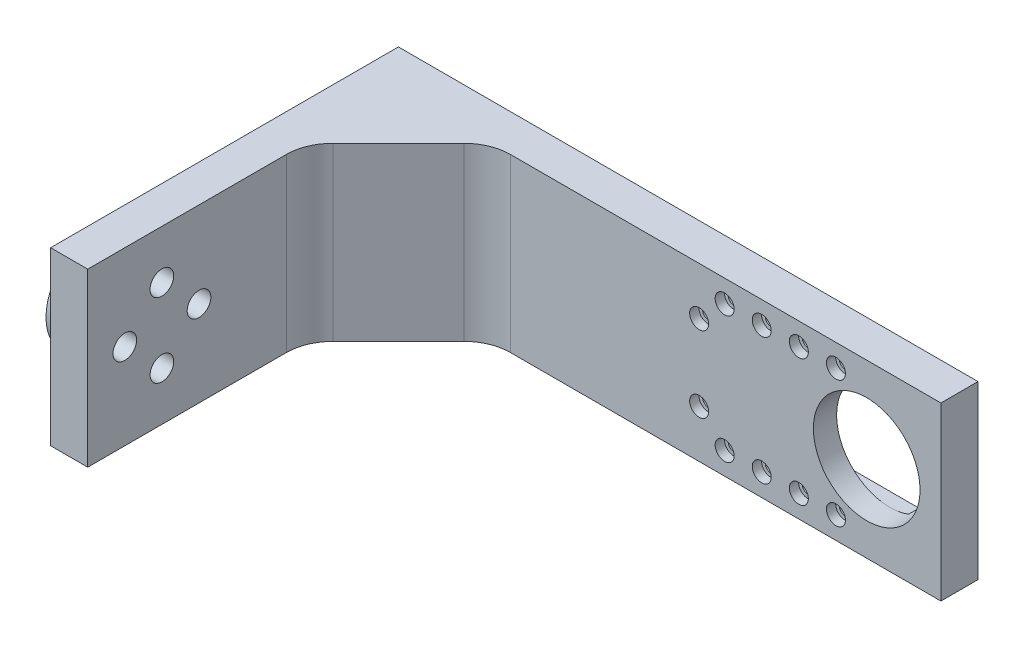
from build123d import *

# Parameters (mm, degrees)
BOSS_EXTRUDE1_DEPTH = 37
CUT_EXTRUDE1_REACH  = 152.396
CUT_EXTRUDE2_REACH  = 152.396
SKETCH3_R           = 1.25
CUT_EXTRUDE5_REACH  = 152.396
SKETCH5_R           = 1.25
BOSS_EXTRUDE3_START = 6
SKETCH6_R           = 11
SKETCH6_R_2         = 1.25
BOSS_EXTRUDE3_DEPTH = 6
SKETCH4_W           = 38
SKETCH4_H           = 23
CUT_EXTRUDE6_DEPTH  = 3
SKETCH9_R           = 2.05
CUT_EXTRUDE8_DEPTH  = 2
SKETCH10_R          = 2.55
CUT_EXTRUDE9_DEPTH  = 6
CHAMFER1_SIZE       = 20
FILLET5_R           = 10
CUT_EXTRUDE10_REACH = 148.571
SKETCH11_R          = 1.25
SKETCH12_R          = 2.05
CUT_EXTRUDE11_DEPTH = 2
SKETCH7_W           = 3
SKETCH7_H           = 23
BOSS_EXTRUDE4_DEPTH = 0.5


with BuildPart() as part:
    # Sketch1 → Boss-Extrude1 (new body)
    with BuildSketch(Plane(origin=(0, 0, 0), x_dir=(1, 0, 0), z_dir=(0, 1, 0))):
        Polygon((0, 0), (0, 75), (125, 75), (125, 67), (8, 67), (8, 0), align=None)
    extrude(amount=BOSS_EXTRUDE1_DEPTH)

    # Sketch2 → Cut-Extrude1 (cut, up to next)
    with BuildSketch(Plane(origin=(0, 0, -75), x_dir=(-1, 0, 0), z_dir=(0, 0, -1)), mode=Mode.PRIVATE) as cut_extrude1_sk1:
        with BuildLine():
            ThreePointArc((-120.5, 18.5), (-109, 7), (-97.5, 18.5))
            ThreePointArc((-97.5, 18.5), (-109, 30), (-120.5, 18.5))
        make_face()
    cut_extrude1_tool1 = extrude(cut_extrude1_sk1.sketch, amount=-CUT_EXTRUDE1_REACH, mode=Mode.PRIVATE) & part.part
    add(cut_extrude1_tool1.solids().sort_by_distance((109, 18.5, -75))[0], mode=Mode.SUBTRACT)

    # Sketch3 → Cut-Extrude2 (cut, up to next)
    with BuildSketch(Plane(origin=(0, 0, -75), x_dir=(-1, 0, 0), z_dir=(0, 0, -1)), mode=Mode.PRIVATE) as cut_extrude2_sk1:
        with Locations((-102.36, 32.19)):
            Circle(SKETCH3_R)
    cut_extrude2_tool1 = extrude(cut_extrude2_sk1.sketch, amount=-CUT_EXTRUDE2_REACH, mode=Mode.PRIVATE) & part.part
    # Sketch3 → Cut-Extrude2 (cut, up to next)
    with BuildSketch(Plane(origin=(0, 0, -75), x_dir=(-1, 0, 0), z_dir=(0, 0, -1)), mode=Mode.PRIVATE) as cut_extrude2_sk2:
        with Locations((-94.36, 32.19)):
            Circle(SKETCH3_R)
    cut_extrude2_tool2 = extrude(cut_extrude2_sk2.sketch, amount=-CUT_EXTRUDE2_REACH, mode=Mode.PRIVATE) & part.part
    # Sketch3 → Cut-Extrude2 (cut, up to next)
    with BuildSketch(Plane(origin=(0, 0, -75), x_dir=(-1, 0, 0), z_dir=(0, 0, -1)), mode=Mode.PRIVATE) as cut_extrude2_sk3:
        with Locations((-86.36, 32.19)):
            Circle(SKETCH3_R)
    cut_extrude2_tool3 = extrude(cut_extrude2_sk3.sketch, amount=-CUT_EXTRUDE2_REACH, mode=Mode.PRIVATE) & part.part
    # Sketch3 → Cut-Extrude2 (cut, up to next)
    with BuildSketch(Plane(origin=(0, 0, -75), x_dir=(-1, 0, 0), z_dir=(0, 0, -1)), mode=Mode.PRIVATE) as cut_extrude2_sk4:
        with Locations((-78.36, 32.19)):
            Circle(SKETCH3_R)
    cut_extrude2_tool4 = extrude(cut_extrude2_sk4.sketch, amount=-CUT_EXTRUDE2_REACH, mode=Mode.PRIVATE) & part.part
    # Sketch3 → Cut-Extrude2 (cut, up to next)
    with BuildSketch(Plane(origin=(0, 0, -75), x_dir=(-1, 0, 0), z_dir=(0, 0, -1)), mode=Mode.PRIVATE) as cut_extrude2_sk5:
        with Locations((-78.36, 4.81)):
            Circle(SKETCH3_R)
    cut_extrude2_tool5 = extrude(cut_extrude2_sk5.sketch, amount=-CUT_EXTRUDE2_REACH, mode=Mode.PRIVATE) & part.part
    # Sketch3 → Cut-Extrude2 (cut, up to next)
    with BuildSketch(Plane(origin=(0, 0, -75), x_dir=(-1, 0, 0), z_dir=(0, 0, -1)), mode=Mode.PRIVATE) as cut_extrude2_sk6:
        with Locations((-86.36, 4.81)):
            Circle(SKETCH3_R)
    cut_extrude2_tool6 = extrude(cut_extrude2_sk6.sketch, amount=-CUT_EXTRUDE2_REACH, mode=Mode.PRIVATE) & part.part
    # Sketch3 → Cut-Extrude2 (cut, up to next)
    with BuildSketch(Plane(origin=(0, 0, -75), x_dir=(-1, 0, 0), z_dir=(0, 0, -1)), mode=Mode.PRIVATE) as cut_extrude2_sk7:
        with Locations((-94.36, 4.81)):
            Circle(SKETCH3_R)
    cut_extrude2_tool7 = extrude(cut_extrude2_sk7.sketch, amount=-CUT_EXTRUDE2_REACH, mode=Mode.PRIVATE) & part.part
    # Sketch3 → Cut-Extrude2 (cut, up to next)
    with BuildSketch(Plane(origin=(0, 0, -75), x_dir=(-1, 0, 0), z_dir=(0, 0, -1)), mode=Mode.PRIVATE) as cut_extrude2_sk8:
        with Locations((-102.36, 4.81)):
            Circle(SKETCH3_R)
    cut_extrude2_tool8 = extrude(cut_extrude2_sk8.sketch, amount=-CUT_EXTRUDE2_REACH, mode=Mode.PRIVATE) & part.part
    add(cut_extrude2_tool1.solids().sort_by_distance((102.36, 32.19, -75))[0], mode=Mode.SUBTRACT)
    add(cut_extrude2_tool2.solids().sort_by_distance((94.36, 32.19, -75))[0], mode=Mode.SUBTRACT)
    add(cut_extrude2_tool3.solids().sort_by_distance((86.36, 32.19, -75))[0], mode=Mode.SUBTRACT)
    add(cut_extrude2_tool4.solids().sort_by_distance((78.36, 32.19, -75))[0], mode=Mode.SUBTRACT)
    add(cut_extrude2_tool5.solids().sort_by_distance((78.36, 4.81, -75))[0], mode=Mode.SUBTRACT)
    add(cut_extrude2_tool6.solids().sort_by_distance((86.36, 4.81, -75))[0], mode=Mode.SUBTRACT)
    add(cut_extrude2_tool7.solids().sort_by_distance((94.36, 4.81, -75))[0], mode=Mode.SUBTRACT)
    add(cut_extrude2_tool8.solids().sort_by_distance((102.36, 4.81, -75))[0], mode=Mode.SUBTRACT)

    # Sketch5 → Cut-Extrude5 (cut, up to next)
    with BuildSketch(Plane.ZY, mode=Mode.PRIVATE) as cut_extrude5_sk1:
        with Locations((-16, 10.5)):
            Circle(SKETCH5_R)
    cut_extrude5_tool1 = extrude(cut_extrude5_sk1.sketch, amount=-CUT_EXTRUDE5_REACH, mode=Mode.PRIVATE) & part.part
    # Sketch5 → Cut-Extrude5 (cut, up to next)
    with BuildSketch(Plane.ZY, mode=Mode.PRIVATE) as cut_extrude5_sk2:
        with Locations((-24, 18.5)):
            Circle(SKETCH5_R)
    cut_extrude5_tool2 = extrude(cut_extrude5_sk2.sketch, amount=-CUT_EXTRUDE5_REACH, mode=Mode.PRIVATE) & part.part
    # Sketch5 → Cut-Extrude5 (cut, up to next)
    with BuildSketch(Plane.ZY, mode=Mode.PRIVATE) as cut_extrude5_sk3:
        with Locations((-16, 26.5)):
            Circle(SKETCH5_R)
    cut_extrude5_tool3 = extrude(cut_extrude5_sk3.sketch, amount=-CUT_EXTRUDE5_REACH, mode=Mode.PRIVATE) & part.part
    # Sketch5 → Cut-Extrude5 (cut, up to next)
    with BuildSketch(Plane.ZY, mode=Mode.PRIVATE) as cut_extrude5_sk4:
        with Locations((-8, 18.5)):
            Circle(SKETCH5_R)
    cut_extrude5_tool4 = extrude(cut_extrude5_sk4.sketch, amount=-CUT_EXTRUDE5_REACH, mode=Mode.PRIVATE) & part.part
    add(cut_extrude5_tool1.solids().sort_by_distance((0, 10.5, -16))[0], mode=Mode.SUBTRACT)
    add(cut_extrude5_tool2.solids().sort_by_distance((0, 18.5, -24))[0], mode=Mode.SUBTRACT)
    add(cut_extrude5_tool3.solids().sort_by_distance((0, 26.5, -16))[0], mode=Mode.SUBTRACT)
    add(cut_extrude5_tool4.solids().sort_by_distance((0, 18.5, -8))[0], mode=Mode.SUBTRACT)

    # Sketch6 → Boss-Extrude3 (add)
    with BuildSketch(Plane.ZY.offset(BOSS_EXTRUDE3_START)):
        with Locations((-16, 18.5)):
            Circle(SKETCH6_R)
        with Locations((-16, 10.5)):
            Circle(SKETCH6_R_2, mode=Mode.SUBTRACT)
        with BuildLine():
            ThreePointArc((-9.25, 18.5), (-8, 19.75), (-6.75, 18.5))
            ThreePointArc((-6.75, 18.5), (-8, 17.25), (-9.25, 18.5))
        make_face(mode=Mode.SUBTRACT)
        with Locations((-24, 18.5)):
            Circle(SKETCH6_R_2, mode=Mode.SUBTRACT)
        with Locations((-16, 26.5)):
            Circle(SKETCH6_R_2, mode=Mode.SUBTRACT)
    extrude(amount=-BOSS_EXTRUDE3_DEPTH)

    # Sketch4 → Cut-Extrude6 (cut)
    with BuildSketch(Plane(origin=(0, 0, -75), x_dir=(-1, 0, 0), z_dir=(0, 0, -1))):
        with Locations((-94, 18.5)):
            Rectangle(SKETCH4_W, SKETCH4_H)
    extrude(amount=-CUT_EXTRUDE6_DEPTH, mode=Mode.SUBTRACT)

    # Sketch9 → Cut-Extrude8 (cut)
    with BuildSketch(Plane.XY.offset(-67)):
        with Locations((78.36, 32.19)):
            Circle(SKETCH9_R)
        with Locations((86.36, 32.19)):
            Circle(SKETCH9_R)
        with Locations((94.36, 32.19)):
            Circle(SKETCH9_R)
        with Locations((102.36, 32.19)):
            Circle(SKETCH9_R)
        with Locations((78.36, 4.81)):
            Circle(SKETCH9_R)
        with Locations((86.36, 4.81)):
            Circle(SKETCH9_R)
        with Locations((94.36, 4.81)):
            Circle(SKETCH9_R)
        with Locations((102.36, 4.81)):
            Circle(SKETCH9_R)
    extrude(amount=-CUT_EXTRUDE8_DEPTH, mode=Mode.SUBTRACT)

    # Sketch10 → Cut-Extrude9 (cut)
    with BuildSketch(Plane(origin=(8, 0, 0), x_dir=(0, 0, -1), z_dir=(1, 0, 0))):
        with Locations((24, 18.5)):
            Circle(SKETCH10_R)
        with Locations((16, 10.5)):
            Circle(SKETCH10_R)
        with Locations((8, 18.5)):
            Circle(SKETCH10_R)
        with Locations((16, 26.5)):
            Circle(SKETCH10_R)
    extrude(amount=-CUT_EXTRUDE9_DEPTH, mode=Mode.SUBTRACT)

    # Chamfer1
    chamfer1_edges = [part.edges().sort_by_distance(p)[0] for p in [
        (8, 18.5, -67),
    ]]
    chamfer(chamfer1_edges, length=CHAMFER1_SIZE)

    # Fillet5
    fillet5_edges = [part.edges().sort_by_distance(p)[0] for p in [
        (8, 18.5, -47),
        (28, 18.5, -67),
    ]]
    fillet(fillet5_edges, radius=FILLET5_R)

    # Sketch11 → Cut-Extrude10 (cut, up to next)
    with BuildSketch(Plane.XY.offset(-67), mode=Mode.PRIVATE) as cut_extrude10_sk1:
        with Locations((72.86, 10.31)):
            Circle(SKETCH11_R)
    cut_extrude10_tool1 = extrude(cut_extrude10_sk1.sketch, amount=-CUT_EXTRUDE10_REACH, mode=Mode.PRIVATE) & part.part
    # Sketch11 → Cut-Extrude10 (cut, up to next)
    with BuildSketch(Plane.XY.offset(-67), mode=Mode.PRIVATE) as cut_extrude10_sk2:
        with Locations((72.86, 26.69)):
            Circle(SKETCH11_R)
    cut_extrude10_tool2 = extrude(cut_extrude10_sk2.sketch, amount=-CUT_EXTRUDE10_REACH, mode=Mode.PRIVATE) & part.part
    add(cut_extrude10_tool1.solids().sort_by_distance((72.86, 10.31, -67))[0], mode=Mode.SUBTRACT)
    add(cut_extrude10_tool2.solids().sort_by_distance((72.86, 26.69, -67))[0], mode=Mode.SUBTRACT)

    # Sketch12 → Cut-Extrude11 (cut)
    with BuildSketch(Plane.XY.offset(-67)):
        with Locations((72.86, 10.31)):
            Circle(SKETCH12_R)
        with Locations((72.86, 26.69)):
            Circle(SKETCH12_R)
    extrude(amount=-CUT_EXTRUDE11_DEPTH, mode=Mode.SUBTRACT)

    # Sketch7 → Boss-Extrude4 (add)
    with BuildSketch(Plane(origin=(75, 0, 0), x_dir=(0, 0, -1), z_dir=(1, 0, 0))):
        with Locations((73.5, 18.5)):
            Rectangle(SKETCH7_W, SKETCH7_H)
    extrude(amount=BOSS_EXTRUDE4_DEPTH)


solid = part.part
